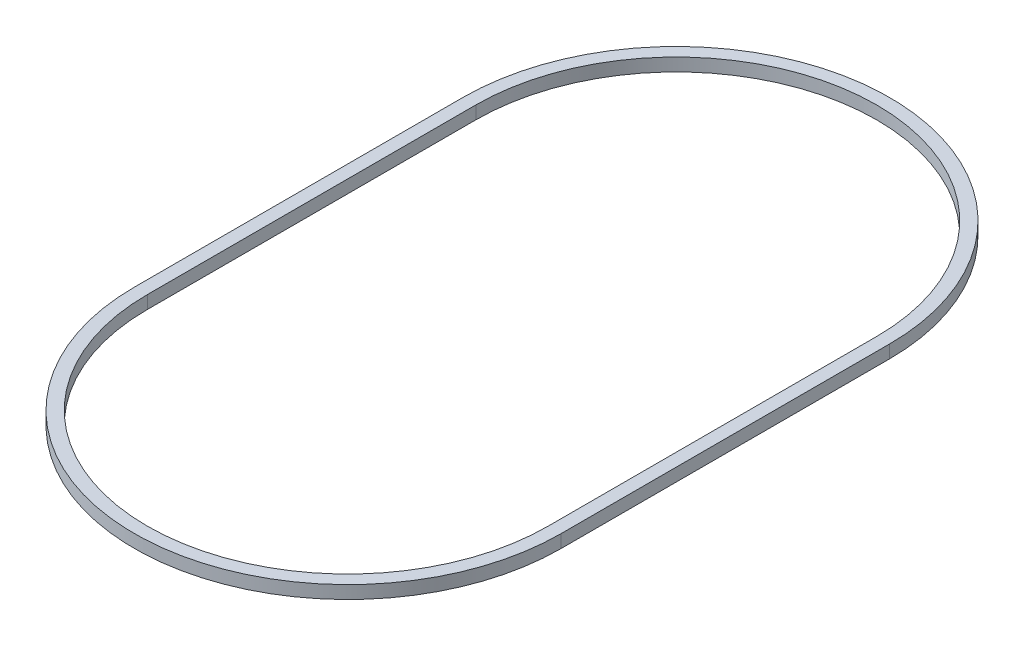
from build123d import *

# Parameters (mm, degrees)
RESSALTO_EXTRUS_O1_DEPTH = 2.5


with BuildPart() as part:
    # Esboço1 → Ressalto-extrusão1 (new body)
    with BuildSketch(Plane(origin=(0, 0, 0), x_dir=(1, 0, 0), z_dir=(0, 1, 0))):
        with BuildLine():
            Line((41.25, 31.75), (41.25, -31.75))
            ThreePointArc((41.25, -31.75), (0, -73), (-41.25, -31.75))
            Line((-41.25, -31.75), (-41.25, 31.75))
            ThreePointArc((-41.25, 31.75), (0, 73), (41.25, 31.75))
        make_face()
        with BuildLine():
            Line((38.75, 31.75), (38.75, -31.75))
            ThreePointArc((38.75, -31.75), (0, -70.5), (-38.75, -31.75))
            Line((-38.75, -31.75), (-38.75, 31.75))
            ThreePointArc((-38.75, 31.75), (0, 70.5), (38.75, 31.75))
        make_face(mode=Mode.SUBTRACT)
    extrude(amount=RESSALTO_EXTRUS_O1_DEPTH)


solid = part.part
